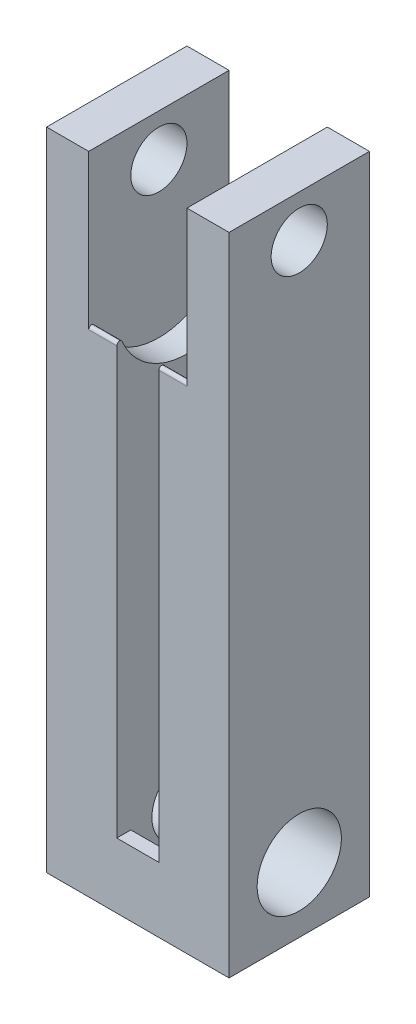
from build123d import *

# Parameters (mm, degrees)
SKETCH1_W               = 65
SKETCH1_H               = 50
BOSS_EXTRUDE1_DEPTH     = 10
SKETCH2_W               = 15
SKETCH2_H               = 50
BOSS_EXTRUDE2_DEPTH     = 70
CUT_EXTRUDE1_DEPTH      = 107.77078252
CUT_EXTRUDE1_DEPTH_BACK = 107.77078252
SKETCH3_R               = 10
BOSS_EXTRUDE7_REACH     = 108.771
FILLET1_R               = 1
SKETCH6_W               = 25
SKETCH6_H               = 50
BOSS_EXTRUDE8_DEPTH     = 150
SKETCH7_R               = 12.5
CUT_EXTRUDE2_DEPTH      = 150
SKETCH8_W               = 15
SKETCH8_H               = 50
CUT_EXTRUDE3_DEPTH      = 150
SKETCH11_W              = 25
SKETCH11_H              = 50
BOSS_EXTRUDE9_DEPTH     = 150
SKETCH12_R              = 15
CUT_EXTRUDE4_DEPTH      = 150
BOSS_EXTRUDE10_DEPTH    = 15


with BuildPart() as part:
    # Sketch1 → Boss-Extrude1 (new body)
    with BuildSketch(Plane(origin=(0, 0, 0), x_dir=(1, 0, 0), z_dir=(0, 1, 0))):
        with Locations((-32.5, 25)):
            Rectangle(SKETCH1_W, SKETCH1_H)
    extrude(amount=BOSS_EXTRUDE1_DEPTH)

    # Sketch2 → Boss-Extrude2 (add)
    with BuildSketch(Plane(origin=(0, 10, 0), x_dir=(1, 0, 0), z_dir=(0, 1, 0))):
        with Locations((-57.5, 25)):
            Rectangle(SKETCH2_W, SKETCH2_H)
        with Locations((-7.5, 25)):
            Rectangle(SKETCH2_W, SKETCH2_H)
    extrude(amount=BOSS_EXTRUDE2_DEPTH)

    # Sketch3 → Cut-Extrude1 (cut, two sides: drawn at the far end of the back side and taken through both)
    with BuildSketch(Plane(origin=(-50, 0, 0), x_dir=(0, 0, -1), z_dir=(1, 0, 0)).offset(-CUT_EXTRUDE1_DEPTH_BACK)):
        with Locations((25, 65)):
            Circle(SKETCH3_R)
    extrude(amount=CUT_EXTRUDE1_DEPTH + CUT_EXTRUDE1_DEPTH_BACK, mode=Mode.SUBTRACT)

    # Sketch5 → Boss-Extrude7 (add, up to next)
    with BuildSketch(Plane(origin=(-50, 0, 0), x_dir=(0, 0, -1), z_dir=(1, 0, 0)), mode=Mode.PRIVATE) as boss_extrude7_sk1:
        with BuildLine():
            Line((50, 10), (50, 35))
            ThreePointArc((50, 35), (42.67766953, 17.32233047), (25, 10))
            Line((25, 10), (50, 10))
        make_face()
    boss_extrude7_tool1 = extrude(boss_extrude7_sk1.sketch, amount=BOSS_EXTRUDE7_REACH, mode=Mode.PRIVATE) - part.part
    # Sketch5 → Boss-Extrude7 (add, up to next)
    with BuildSketch(Plane(origin=(-50, 0, 0), x_dir=(0, 0, -1), z_dir=(1, 0, 0)), mode=Mode.PRIVATE) as boss_extrude7_sk2:
        with BuildLine():
            ThreePointArc((25, 10), (7.32233047, 17.32233047), (0, 35))
            Line((0, 35), (0, 10))
            Line((0, 10), (25, 10))
        make_face()
    boss_extrude7_tool2 = extrude(boss_extrude7_sk2.sketch, amount=BOSS_EXTRUDE7_REACH, mode=Mode.PRIVATE) - part.part
    add(boss_extrude7_tool1.solids().sort_by_distance((-50, 15.584198, -44.415802))[0])
    add(boss_extrude7_tool2.solids().sort_by_distance((-50, 15.584198, -5.584198))[0])

    # Fillet1
    fillet1_edges = [part.edges().sort_by_distance(p)[0] for p in [
        (-32.5, 35, -50),
        (-32.5, 35, 0),
    ]]
    fillet(fillet1_edges, radius=FILLET1_R)

    # Sketch6 → Boss-Extrude8 (add)
    with BuildSketch(Plane.XZ):
        with Locations((-52.5, -25)):
            Rectangle(SKETCH6_W, SKETCH6_H)
    extrude(amount=BOSS_EXTRUDE8_DEPTH)

    # Sketch7 → Cut-Extrude2 (cut)
    with BuildSketch(Plane(origin=(-40, 0, 0), x_dir=(0, 0, -1), z_dir=(1, 0, 0))):
        with Locations((25, -126.825479142)):
            Circle(SKETCH7_R)
    extrude(amount=-CUT_EXTRUDE2_DEPTH, mode=Mode.SUBTRACT)

    # Sketch8 → Cut-Extrude3 (cut)
    with BuildSketch(Plane.XZ):
        with Locations((-32.5, -25)):
            Rectangle(SKETCH8_W, SKETCH8_H)
    extrude(amount=-CUT_EXTRUDE3_DEPTH, mode=Mode.SUBTRACT)


with BuildPart() as cut_extrude3_piece_1:
    # of the separate pieces the step leaves, piece 1, a body of its own (cut_extrude3_pieces)
    add(part.part.solids().sort_by_distance((-50, 25, 0))[0])



with BuildPart() as cut_extrude3_piece_2:
    # of the separate pieces the step leaves, piece 2, a body of its own (cut_extrude3_pieces)
    add(part.part.solids().sort_by_distance((-25, 25, 0))[0])

    # Sketch11 → Boss-Extrude9 (add)
    with BuildSketch(Plane.XZ):
        with Locations((-12.5, -25)):
            Rectangle(SKETCH11_W, SKETCH11_H)
    extrude(amount=BOSS_EXTRUDE9_DEPTH)

    # Sketch12 → Cut-Extrude4 (cut)
    with BuildSketch(Plane.ZY.offset(25)):
        with Locations((-25, -126.825479142)):
            Circle(SKETCH12_R)
    extrude(amount=-CUT_EXTRUDE4_DEPTH, mode=Mode.SUBTRACT)


with BuildPart() as cut_extrude3_piece_1_1:
    add(cut_extrude3_piece_1.part)

    add(cut_extrude3_piece_2.part)  # Boss-Extrude10 merges Cut-Extrude3 piece 2
    # Sketch14 → Boss-Extrude10 (add)
    with BuildSketch(Plane.ZY.offset(25)):
        with BuildLine():
            Line((-5, -126.825479142), (0, -126.825479142))
            Line((0, -126.825479142), (0, -150))
            Line((0, -150), (-50, -150))
            Line((-50, -150), (-50, -126.825479142))
            Line((-50, -126.825479142), (-45, -126.825479142))
            ThreePointArc((-45, -126.825479142), (-25, -146.825479142), (-5, -126.825479142))
        make_face()
    extrude(amount=BOSS_EXTRUDE10_DEPTH)


solid = cut_extrude3_piece_1_1.part
